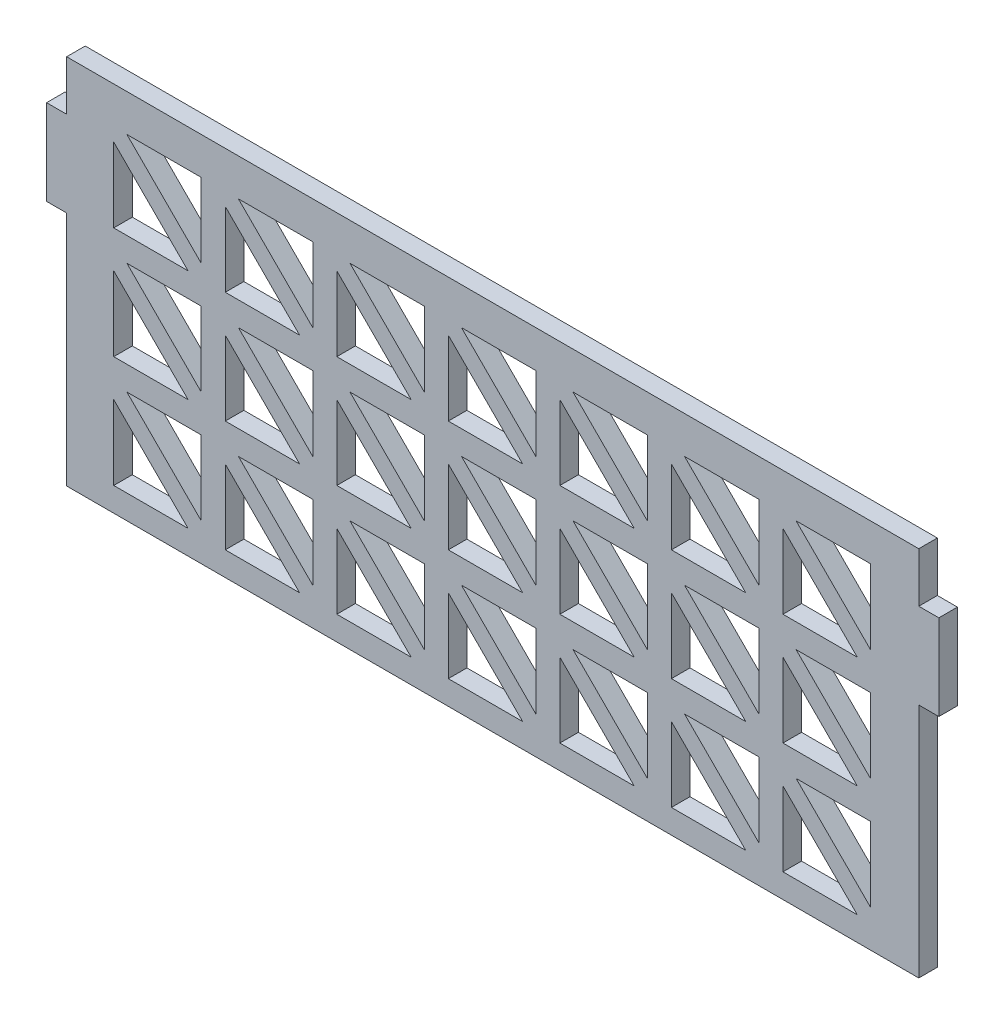
from build123d import *

# Parameters (mm, degrees)
SKETCH1_W           = 152.4
SKETCH1_H           = 241.3
BOSS_EXTRUDE1_DEPTH = 3.175
SKETCH2_W           = 3.429
SKETCH2_H           = 168.148
SKETCH2_H_2         = 40.386
CUT_EXTRUDE1_DEPTH  = 286.414664348
SKETCH3_W           = 119.38
SKETCH3_H           = 119.38
SKETCH3_W_2         = 74.6125
SKETCH3_H_2         = 25.4
SKETCH3_W_3         = 12.7
SKETCH3_H_3         = 16.256
SKETCH3_W_4         = 5.334
SKETCH3_H_4         = 7.239
CUT_EXTRUDE2_DEPTH  = 286.414664348
SKETCH4_W           = 194.284224207
SKETCH4_H           = 180.265938869
CUT_EXTRUDE4_DEPTH  = 286.414664348


with BuildPart() as part:
    # Sketch1 → Boss-Extrude1 (new body)
    with BuildSketch(Plane.XY):
        with Locations((76.2, 120.65)):
            Rectangle(SKETCH1_W, SKETCH1_H)
    extrude(amount=BOSS_EXTRUDE1_DEPTH)

    # Sketch2 → Cut-Extrude1 (cut, through all)
    with BuildSketch(Plane.XY.offset(3.175)):
        with Locations((150.6855, 139.065)):
            Rectangle(SKETCH2_W, SKETCH2_H)
        with Locations((1.7145, 139.065)):
            Rectangle(SKETCH2_W, SKETCH2_H)
        with Locations((150.6855, 20.193)):
            Rectangle(SKETCH2_W, SKETCH2_H_2)
        with Locations((1.7145, 20.193)):
            Rectangle(SKETCH2_W, SKETCH2_H_2)
    extrude(amount=-CUT_EXTRUDE1_DEPTH, mode=Mode.SUBTRACT)

    # Sketch3 → Cut-Extrude2 (cut, through all)
    with BuildSketch(Plane.XY.offset(3.175)):
        Polygon((128.016, 57.15), (140.716, 57.15), (140.716, 44.45), align=None)
        Polygon((125.77093597, 42.20493597), (138.47093597, 42.20493597), (125.77093597, 54.90493597), align=None)
        Polygon((108.966, 57.15), (121.666, 57.15), (121.666, 44.45), align=None)
        Polygon((119.42093597, 42.20493597), (106.72093597, 54.90493597), (106.72093597, 42.20493597), align=None)
        Polygon((89.916, 57.15), (102.616, 57.15), (102.616, 44.45), align=None)
        Polygon((100.37093597, 42.20493597), (87.67093597, 54.90493597), (87.67093597, 42.20493597), align=None)
        Polygon((70.866, 57.15), (83.566, 57.15), (83.566, 44.45), align=None)
        Polygon((81.32093597, 42.20493597), (68.62093597, 54.90493597), (68.62093597, 42.20493597), align=None)
        Polygon((51.816, 57.15), (64.516, 57.15), (64.516, 44.45), align=None)
        Polygon((62.27093597, 42.20493597), (49.57093597, 54.90493597), (49.57093597, 42.20493597), align=None)
        Polygon((32.766, 57.15), (45.466, 57.15), (45.466, 44.45), align=None)
        Polygon((43.22093597, 42.20493597), (30.52093597, 54.90493597), (30.52093597, 42.20493597), align=None)
        Polygon((13.716, 57.15), (26.416, 57.15), (26.416, 44.45), align=None)
        Polygon((24.17093597, 42.20493597), (11.47093597, 54.90493597), (11.47093597, 42.20493597), align=None)
        Polygon((128.016, 38.1), (140.716, 38.1), (140.716, 25.4), align=None)
        with Locations((76.454, 129.159)):
            Rectangle(SKETCH3_W, SKETCH3_H)
        Polygon((125.77093597, 23.15493597), (138.47093597, 23.15493597), (125.77093597, 35.85493597), align=None)
        Polygon((108.966, 38.1), (121.666, 38.1), (121.666, 25.4), align=None)
        Polygon((119.42093597, 23.15493597), (106.72093597, 35.85493597), (106.72093597, 23.15493597), align=None)
        Polygon((89.916, 38.1), (102.616, 38.1), (102.616, 25.4), align=None)
        Polygon((100.37093597, 23.15493597), (87.67093597, 35.85493597), (87.67093597, 23.15493597), align=None)
        Polygon((70.866, 38.1), (83.566, 38.1), (83.566, 25.4), align=None)
        Polygon((81.32093597, 23.15493597), (68.62093597, 35.85493597), (68.62093597, 23.15493597), align=None)
        Polygon((51.816, 38.1), (64.516, 38.1), (64.516, 25.4), align=None)
        Polygon((62.27093597, 23.15493597), (49.57093597, 35.85493597), (49.57093597, 23.15493597), align=None)
        Polygon((32.766, 38.1), (45.466, 38.1), (45.466, 25.4), align=None)
        Polygon((43.22093597, 23.15493597), (30.52093597, 35.85493597), (30.52093597, 23.15493597), align=None)
        Polygon((13.716, 38.1), (26.416, 38.1), (26.416, 25.4), align=None)
        Polygon((24.17093597, 23.15493597), (11.47093597, 35.85493597), (11.47093597, 23.15493597), align=None)
        Polygon((128.016, 19.05), (140.716, 19.05), (140.716, 6.35), align=None)
        Polygon((125.77093597, 4.10493597), (138.47093597, 4.10493597), (125.77093597, 16.80493597), align=None)
        Polygon((108.966, 19.05), (121.666, 19.05), (121.666, 6.35), align=None)
        Polygon((119.42093597, 4.10493597), (106.72093597, 16.80493597), (106.72093597, 4.10493597), align=None)
        Polygon((89.916, 19.05), (102.616, 19.05), (102.616, 6.35), align=None)
        Polygon((100.37093597, 4.10493597), (87.67093597, 16.80493597), (87.67093597, 4.10493597), align=None)
        Polygon((70.866, 19.05), (83.566, 19.05), (83.566, 6.35), align=None)
        Polygon((81.32093597, 4.10493597), (68.62093597, 16.80493597), (68.62093597, 4.10493597), align=None)
        Polygon((51.816, 19.05), (64.516, 19.05), (64.516, 6.35), align=None)
        Polygon((62.27093597, 4.10493597), (49.57093597, 16.80493597), (49.57093597, 4.10493597), align=None)
        Polygon((32.766, 19.05), (45.466, 19.05), (45.466, 6.35), align=None)
        Polygon((43.22093597, 4.10493597), (30.52093597, 16.80493597), (30.52093597, 4.10493597), align=None)
        Polygon((13.716, 19.05), (26.416, 19.05), (26.416, 6.35), align=None)
        Polygon((24.17093597, 4.10493597), (11.47093597, 16.80493597), (11.47093597, 4.10493597), align=None)
        with Locations((54.07025, 215.519)):
            Rectangle(SKETCH3_W_2, SKETCH3_H_2)
        with Locations((129.794, 210.947)):
            Rectangle(SKETCH3_W_3, SKETCH3_H_3)
        with Locations((104.0765, 206.4385)):
            Rectangle(SKETCH3_W_4, SKETCH3_H_4)
    extrude(amount=-CUT_EXTRUDE2_DEPTH, mode=Mode.SUBTRACT)

    # Sketch4 → Cut-Extrude4 (cut, through all)
    with BuildSketch(Plane.XY.offset(3.175)):
        with Locations((76.027835775, 153.632969435)):
            Rectangle(SKETCH4_W, SKETCH4_H)
    extrude(amount=-CUT_EXTRUDE4_DEPTH, mode=Mode.SUBTRACT)


solid = part.part
